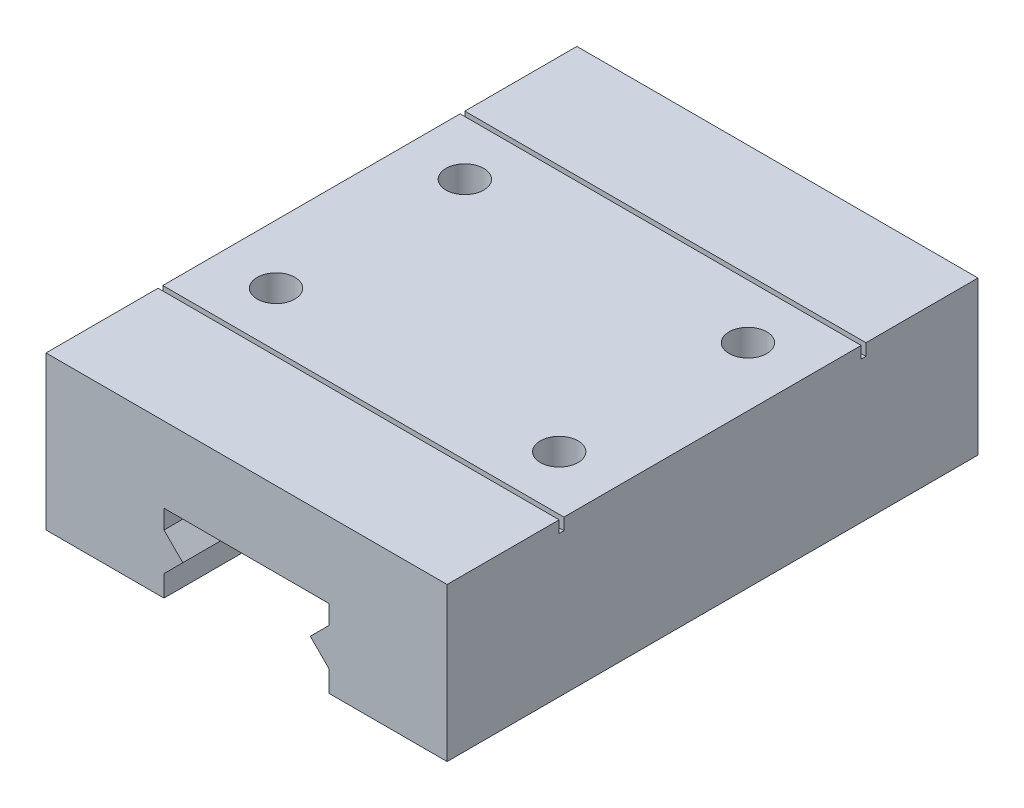
from build123d import *

# Parameters (mm, degrees)
EXTRUDE_1_DEPTH        = 22.5
SKETCH_3_W             = 17
SKETCH_3_H             = 0.2
CUT_EXTRUDE_1_DEPTH    = 0.5
HOLE_WIZARD_M2_1_D     = 1.6
HOLE_WIZARD_M2_1_DEPTH = 4.2
HOLE_WIZARD_M2_1_TIP   = 0.480688495


with BuildPart() as part:
    # 草图2 → 凸台-拉伸1 (new body)
    with BuildSketch(Plane.XY):
        Polygon((-8.5, 0), (8.5, 0), (8.5, -6.5), (3.5, -6.5), (3.5, -5.6), (2.7, -4.8), (3.5, -4), (3.5, -3.2), (-3.5, -3.2), (-3.5, -4), (-2.7, -4.8), (-3.5, -5.6), (-3.5, -6.5), (-8.5, -6.5), align=None)
    extrude(amount=EXTRUDE_1_DEPTH)

    # 草图3 → 切除-拉伸1 (cut)
    with BuildSketch(Plane(origin=(0, 0, 0), x_dir=(1, 0, 0), z_dir=(0, 1, 0))):
        with Locations((0, -17.65)):
            Rectangle(SKETCH_3_W, SKETCH_3_H)
        with Locations((0, -4.85)):
            Rectangle(SKETCH_3_W, SKETCH_3_H)
    extrude(amount=-CUT_EXTRUDE_1_DEPTH, mode=Mode.SUBTRACT)

    # M2 螺纹孔1
    with Locations(Plane(origin=(0, 0, 0), x_dir=(1, 0, 0), z_dir=(0, 1, 0))):
        with Locations((-6, -7.25), (6, -7.25), (6, -15.25), (-6, -15.25)):
            Hole(HOLE_WIZARD_M2_1_D / 2, depth=HOLE_WIZARD_M2_1_DEPTH)
            with Locations((0, 0, -(HOLE_WIZARD_M2_1_DEPTH + HOLE_WIZARD_M2_1_TIP / 2))):  # 118° drill point
                Cone(0, HOLE_WIZARD_M2_1_D / 2, HOLE_WIZARD_M2_1_TIP, mode=Mode.SUBTRACT)


solid = part.part
